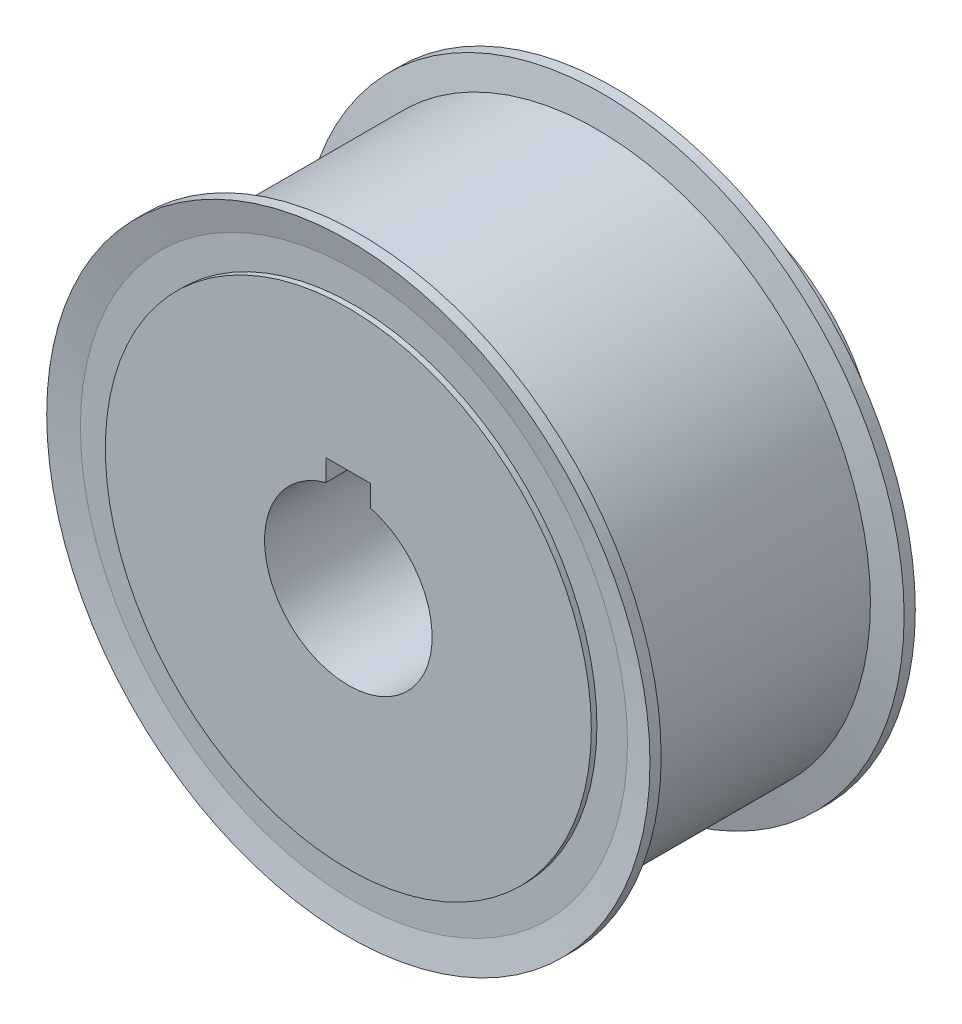
from build123d import *

# Parameters (mm, degrees)
SKETCH2_W                  = 65
SKETCH2_H                  = 15
CUT_EXTRUDE1_DEPTH         = 101.284595028
M6X1_0_TAPPED_HOLE1_REACH  = 147.812
M6X1_0_TAPPED_HOLE1_BORE_R = 2.5
CIRPATTERN1_COUNT          = 2
CIRPATTERN1_ANGLE          = 120


with BuildPart() as part:
    # Sketch1 → Revolve1 (revolve)
    with BuildSketch(Plane(origin=(0, 0, 0), x_dir=(0, 0, -1), z_dir=(1, 0, 0)), mode=Mode.PRIVATE) as revolve1_sk:
        Polygon((-65, 43.5), (-64, 43.5), (-64, 48.965), (-65, 54), (-63, 54), (-62, 48.965), (-20.5, 48.965), (-19.5, 54), (-17.5, 54), (-18.5, 48.965), (-18.5, 43.5), (-17.5, 43.5), (-17.5, 30), (0, 30), (0, 0), (-65, 0), align=None)
    revolve(revolve1_sk.sketch.rotate(Axis((0, 0, 66.142918398), (0, 0, -1)), 90), axis=Axis((0, 0, 66.142918398), (0, 0, -1)))

    # Sketch2 → Cut-Revolve1 (revolve, cut)
    with BuildSketch(Plane(origin=(0, 0, 0), x_dir=(0, 0, -1), z_dir=(1, 0, 0)), mode=Mode.PRIVATE) as cut_revolve1_sk:
        with Locations((-32.5, 7.5)):
            Rectangle(SKETCH2_W, SKETCH2_H)
    revolve(cut_revolve1_sk.sketch.rotate(Axis((0, 0, -15.356501925), (0, 0, 1)), 90), axis=Axis((0, 0, -15.356501925), (0, 0, 1)), mode=Mode.SUBTRACT)

    # Sketch3 → Cut-Extrude1 (cut, through all)
    with BuildSketch(Plane.XY.offset(65)):
        with BuildLine():
            Line((-4, 18.3), (4, 18.3))
            Line((4, 18.3), (4, 14.456832295))
            ThreePointArc((4, 14.456832295), (0, 15), (-4, 14.456832295))
            Line((-4, 14.456832295), (-4, 18.3))
        make_face()
    extrude(amount=-CUT_EXTRUDE1_DEPTH, mode=Mode.SUBTRACT)

    # M6x1.0 Tapped Hole1 bore → M6x1.0 Tapped Hole1 (cut, up to next)
    with BuildSketch(Plane(origin=(0, 30, -41.25), x_dir=(-1, 0, 0), z_dir=(0, 1, 0)), mode=Mode.PRIVATE) as m6x1_0_tapped_hole1_sk1:
        with Locations((0, 49.25)):
            Circle(M6X1_0_TAPPED_HOLE1_BORE_R)
    m6x1_0_tapped_hole1_tool1 = extrude(m6x1_0_tapped_hole1_sk1.sketch, amount=-M6X1_0_TAPPED_HOLE1_REACH, mode=Mode.PRIVATE) & part.part
    m6x1_0_tapped_hole1 = m6x1_0_tapped_hole1_tool1.solids().sort_by_distance((0, 30, 8))[0]
    add(m6x1_0_tapped_hole1, mode=Mode.SUBTRACT)

    # CirPattern1: M6x1.0 Tapped Hole1; each copy of M6x1.0 Tapped Hole1 runs up to whatever stops it at its own place
    cirpattern1_before = part.part  # the part as the pattern finds it: every copy runs up to it
    cirpattern1_m6x1_0_tapped_hole1_long = extrude(m6x1_0_tapped_hole1_sk1.sketch, amount=-M6X1_0_TAPPED_HOLE1_REACH, mode=Mode.PRIVATE)
    cirpattern1_m6x1_0_tapped_hole1_tool1 = cirpattern1_m6x1_0_tapped_hole1_long.rotate(Axis((0, 0, -15.356501925), (0, 0, 1)), 1 * CIRPATTERN1_ANGLE / (CIRPATTERN1_COUNT - 1)) & cirpattern1_before
    add(cirpattern1_m6x1_0_tapped_hole1_tool1.solids().sort_by_distance((-25.980762, -15, 8))[0], mode=Mode.SUBTRACT)


solid = part.part
